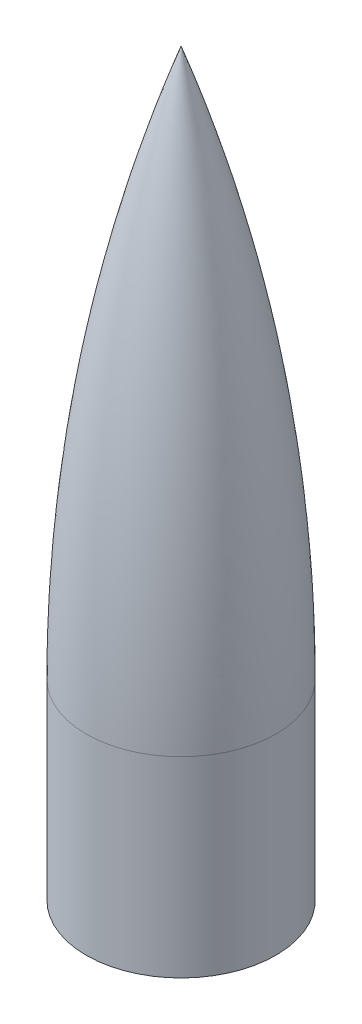
from build123d import *


with BuildPart() as part:
    # Sketch1 → Revolve1 (revolve)
    with BuildSketch(Plane.XY, mode=Mode.PRIVATE) as revolve1_sk:
        with BuildLine():
            Line((0, 229), (0, 219.905427331))
            ThreePointArc((0, 219.905427331), (27.387497442, 111.465192964), (36.6, 0))
            Line((36.6, 0), (36.6, -80))
            Line((36.6, -80), (39.6, -80))
            Line((39.6, -80), (39.6, 0))
            ThreePointArc((39.6, 0), (29.627075608, 116.199354559), (0, 229))
        make_face()
    revolve(revolve1_sk.sketch.rotate(Axis((0, 229, 0), (0, -1, 0)), 90), axis=Axis((0, 229, 0), (0, -1, 0)))


solid = part.part
